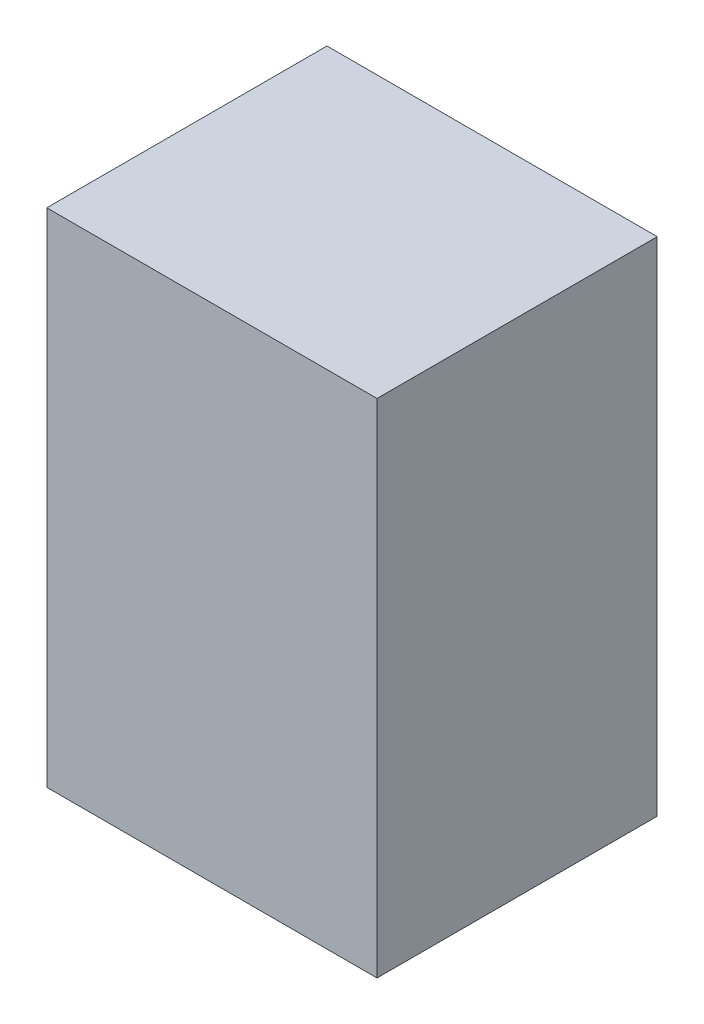
from build123d import *

# Parameters (mm, degrees)
SKETCH1_W           = 66
SKETCH1_H           = 100.3
BOSS_EXTRUDE1_DEPTH = 28


with BuildPart() as part:
    # Sketch1 → Boss-Extrude1 (new, symmetric)
    with BuildSketch(Plane.XY):
        Rectangle(SKETCH1_W, SKETCH1_H)
    extrude(amount=BOSS_EXTRUDE1_DEPTH, both=True)


solid = part.part
